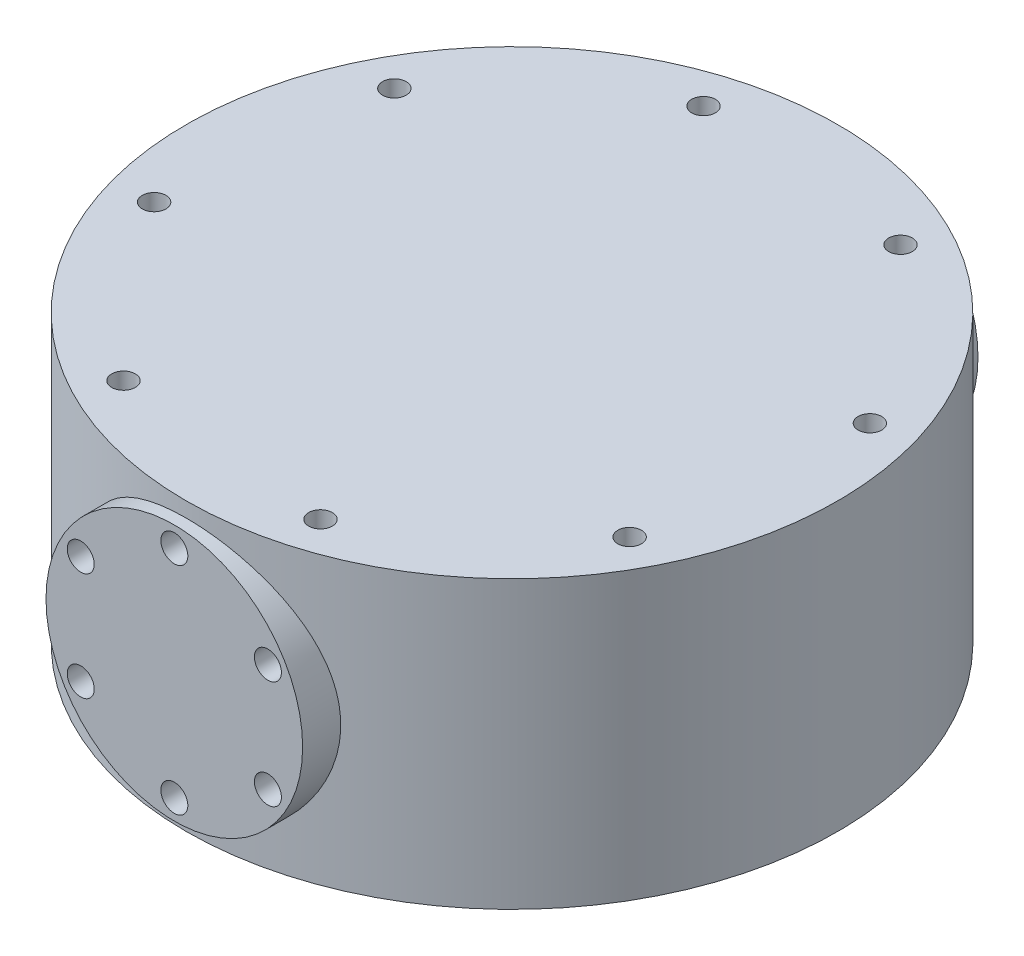
from build123d import *

# Parameters (mm, degrees)
SKETCH_1_R               = 48.25
EXTRUDE_2_DEPTH          = 42.4
SKETCH_2_R               = 1.75
CUT_EXTRUDE_1_DEPTH      = 81.336075334
PATTERN_CIRCULAR_2_COUNT = 8
SKETCH_4_R               = 19
EXTRUDE_4_DEPTH          = 50
SKETCH_5_R               = 2
CUT_EXTRUDE_2_DEPTH      = 119.852103634
PATTERN_CIRCULAR_3_COUNT = 6


with BuildPart() as part:
    # 草图1 → 凸台-拉伸2 (new body)
    with BuildSketch(Plane(origin=(0, 0, 0), x_dir=(1, 0, 0), z_dir=(0, 1, 0))):
        with Locations(Location((0, 0, 0), (0, 0, 270))):
            Circle(SKETCH_1_R)
    extrude(amount=EXTRUDE_2_DEPTH)

    # 草图2 → 切除-拉伸1 (cut, symmetric)
    with BuildSketch(Plane(origin=(0, 42.4, 0), x_dir=(1, 0, 0), z_dir=(0, 1, 0))):
        with Locations(Location((20.051879178, 37.472284978, 0), (0, 0, 270))):
            Circle(SKETCH_2_R)
    cut_extrude_1 = extrude(amount=CUT_EXTRUDE_1_DEPTH, both=True, mode=Mode.SUBTRACT)

    # 阵列(圆周)2: 切除-拉伸1 ×8 about axis
    pattern_circular_2_axis = Axis((0, 0, 0), (0, 1, 0))
    for i in range(1, PATTERN_CIRCULAR_2_COUNT):
        add(cut_extrude_1.rotate(pattern_circular_2_axis, i * 360 / PATTERN_CIRCULAR_2_COUNT), mode=Mode.SUBTRACT)

    # 草图4 → 凸台-拉伸4 (add, symmetric)
    with BuildSketch(Plane.XY):
        with Locations(Location((0, 21.2, 0), (0, 0, 180))):
            Circle(SKETCH_4_R)
    extrude(amount=EXTRUDE_4_DEPTH, both=True)

    # 草图5 → 切除-拉伸2 (cut, symmetric)
    with BuildSketch(Plane.XY.offset(50)):
        with Locations((0, 37.2)):
            Circle(SKETCH_5_R)
    cut_extrude_2 = extrude(amount=CUT_EXTRUDE_2_DEPTH, both=True, mode=Mode.SUBTRACT)

    # 阵列(圆周)3: 切除-拉伸2 ×6 about axis
    pattern_circular_3_axis = Axis((0, 21.2, 0), (0, 0, 1))
    for i in range(1, PATTERN_CIRCULAR_3_COUNT):
        add(cut_extrude_2.rotate(pattern_circular_3_axis, i * 360 / PATTERN_CIRCULAR_3_COUNT), mode=Mode.SUBTRACT)


solid = part.part
